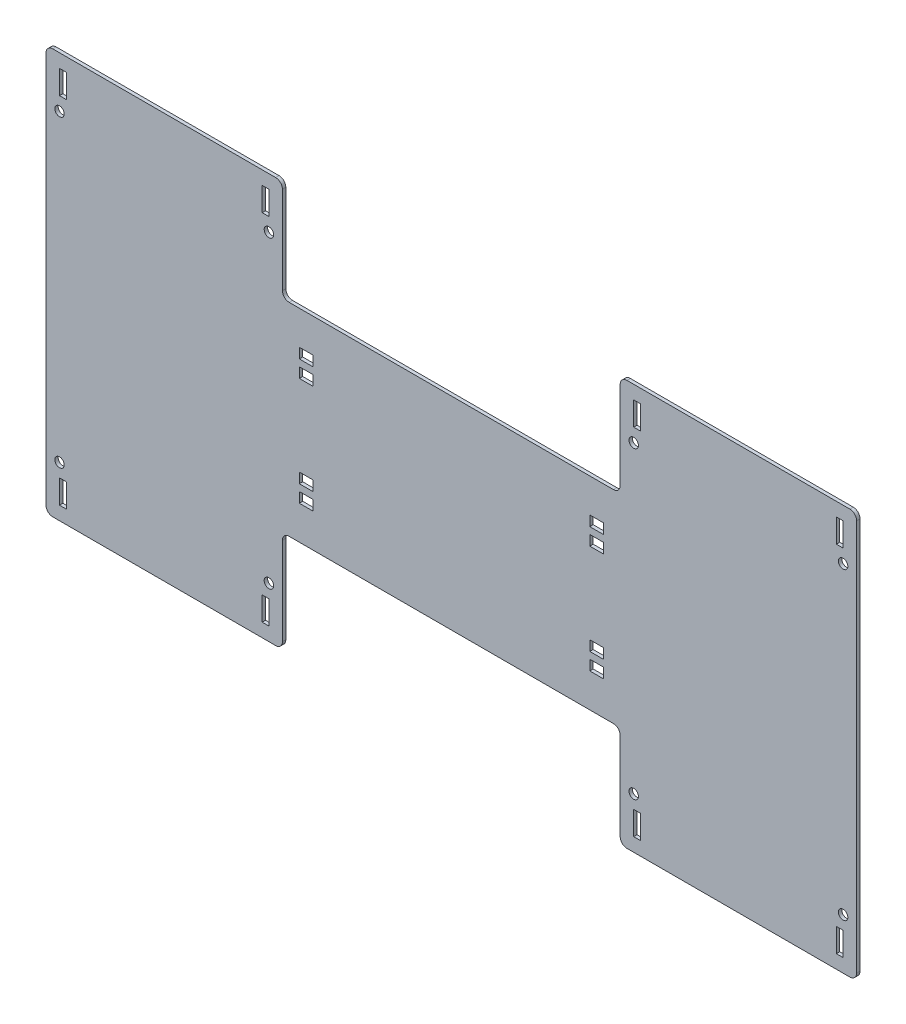
from build123d import *

# Parameters (mm, degrees)
SKETCH_1_R          = 7
SKETCH_1_W          = 20
SKETCH_1_H          = 15
EXTRUDE_1_DEPTH     = 2.5
SKETCH_2_W          = 10
SKETCH_2_H          = 35
CUT_EXTRUDE_3_DEPTH = 671.839026891


with BuildPart() as part:
    # 草图1 → 凸台-拉伸1 (new, symmetric)
    with BuildSketch(Plane.XY):
        with BuildLine():
            Line((-250, 290), (-250, 160))
            ThreePointArc((-250, 160), (-247.071067812, 152.928932188), (-240, 150))
            Line((-240, 150), (240, 150))
            ThreePointArc((240, 150), (247.071067812, 152.928932188), (250, 160))
            Line((250, 160), (250, 290))
            ThreePointArc((250, 290), (252.928932188, 297.071067812), (260, 300))
            Line((260, 300), (590, 300))
            ThreePointArc((590, 300), (597.071067812, 297.071067812), (600, 290))
            Line((600, 290), (600, -290))
            ThreePointArc((600, -290), (597.071067812, -297.071067812), (590, -300))
            Line((590, -300), (260, -300))
            ThreePointArc((260, -300), (252.928932188, -297.071067812), (250, -290))
            Line((250, -290), (250, -160))
            ThreePointArc((250, -160), (247.071067812, -152.928932188), (240, -150))
            Line((240, -150), (-240, -150))
            ThreePointArc((-240, -150), (-247.071067812, -152.928932188), (-250, -160))
            Line((-250, -160), (-250, -290))
            ThreePointArc((-250, -290), (-252.928932188, -297.071067812), (-260, -300))
            Line((-260, -300), (-590, -300))
            ThreePointArc((-590, -300), (-597.071067812, -297.071067812), (-600, -290))
            Line((-600, -290), (-600, 290))
            ThreePointArc((-600, 290), (-597.071067812, 297.071067812), (-590, 300))
            Line((-590, 300), (-260, 300))
            ThreePointArc((-260, 300), (-252.928932188, 297.071067812), (-250, 290))
        make_face()
        with Locations((-580, -225)):
            Circle(SKETCH_1_R, mode=Mode.SUBTRACT)
        with Locations(Location((-580, 225, 0), (0, 0, 180))):
            Circle(SKETCH_1_R, mode=Mode.SUBTRACT)
        with Locations((-270, 225)):
            Circle(SKETCH_1_R, mode=Mode.SUBTRACT)
        with Locations(Location((-270, -225, 0), (0, 0, 180))):
            Circle(SKETCH_1_R, mode=Mode.SUBTRACT)
        with Locations((270, -225)):
            Circle(SKETCH_1_R, mode=Mode.SUBTRACT)
        with Locations(Location((580, -225, 0), (0, 0, 180))):
            Circle(SKETCH_1_R, mode=Mode.SUBTRACT)
        with Locations(Location((270, 225, 0), (0, 0, 180))):
            Circle(SKETCH_1_R, mode=Mode.SUBTRACT)
        with Locations((580, 225)):
            Circle(SKETCH_1_R, mode=Mode.SUBTRACT)
        with Locations((-215, -67.5)):
            Rectangle(SKETCH_1_W, SKETCH_1_H, mode=Mode.SUBTRACT)
        with Locations((-215, 92.5)):
            Rectangle(SKETCH_1_W, SKETCH_1_H, mode=Mode.SUBTRACT)
        with Locations((-215, 67.5)):
            Rectangle(SKETCH_1_W, SKETCH_1_H, mode=Mode.SUBTRACT)
        with Locations((-215, -92.5)):
            Rectangle(SKETCH_1_W, SKETCH_1_H, mode=Mode.SUBTRACT)
        with Locations((215, -92.5)):
            Rectangle(SKETCH_1_W, SKETCH_1_H, mode=Mode.SUBTRACT)
        with Locations((215, 67.5)):
            Rectangle(SKETCH_1_W, SKETCH_1_H, mode=Mode.SUBTRACT)
        with Locations((215, 92.5)):
            Rectangle(SKETCH_1_W, SKETCH_1_H, mode=Mode.SUBTRACT)
        with Locations((215, -67.5)):
            Rectangle(SKETCH_1_W, SKETCH_1_H, mode=Mode.SUBTRACT)
    extrude(amount=EXTRUDE_1_DEPTH, both=True)

    # 草图2 → 切除-拉伸3 (cut, through all)
    with BuildSketch(Plane.XY.offset(2.5)):
        with Locations((-575, 262.5)):
            Rectangle(SKETCH_2_W, SKETCH_2_H)
        with Locations((-575, -262.5)):
            Rectangle(SKETCH_2_W, SKETCH_2_H)
        with Locations((575, -262.5)):
            Rectangle(SKETCH_2_W, SKETCH_2_H)
        with Locations((575, 262.5)):
            Rectangle(SKETCH_2_W, SKETCH_2_H)
        with Locations((275, -262.5)):
            Rectangle(SKETCH_2_W, SKETCH_2_H)
        with Locations((275, 262.5)):
            Rectangle(SKETCH_2_W, SKETCH_2_H)
        with Locations((-275, 262.5)):
            Rectangle(SKETCH_2_W, SKETCH_2_H)
        with Locations((-275, -262.5)):
            Rectangle(SKETCH_2_W, SKETCH_2_H)
    extrude(amount=-CUT_EXTRUDE_3_DEPTH, mode=Mode.SUBTRACT)


solid = part.part
